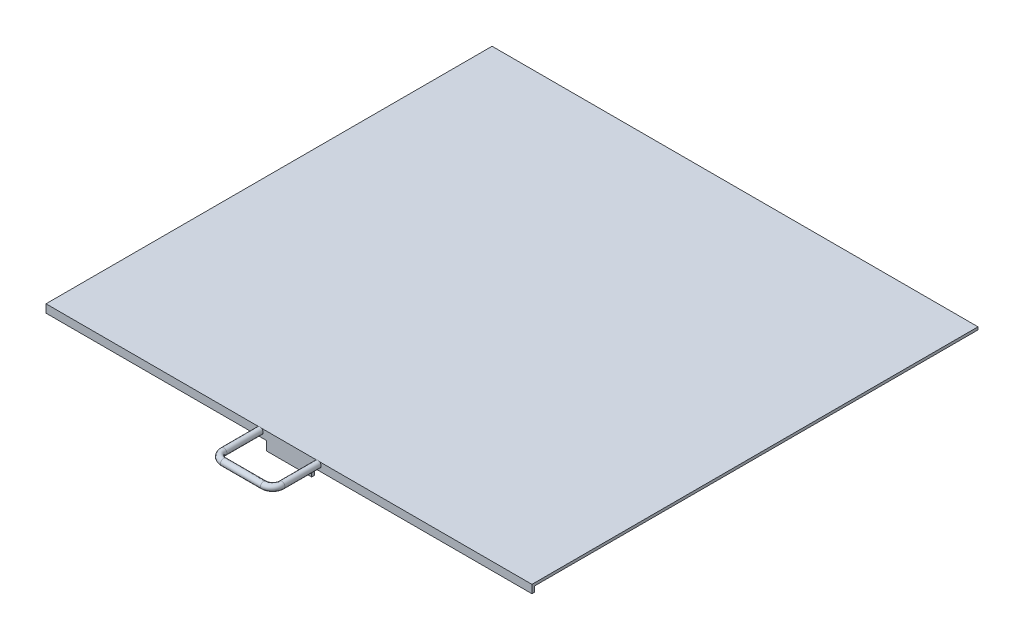
from build123d import *

# Parameters (mm, degrees)
SKETCH1_W           = 268
SKETCH1_H           = 246
BOSS_EXTRUDE1_DEPTH = 1.5
BOSS_EXTRUDE2_DEPTH = 1.5
SWEEP1_PROFILE_R    = 1.75


with BuildPart() as part:
    # Sketch1 → Boss-Extrude1 (new body)
    with BuildSketch(Plane(origin=(0, 0, 0), x_dir=(1, 0, 0), z_dir=(0, 1, 0))):
        Rectangle(SKETCH1_W, SKETCH1_H)
    extrude(amount=BOSS_EXTRUDE1_DEPTH)

    # Sketch2 → Boss-Extrude2 (add)
    with BuildSketch(Plane.XY.offset(123)):
        Polygon((-134, 0), (134, 0), (134, -3), (12.5, -3), (12.5, -8), (-12.5, -8), (-12.5, -3), (-134, -3), align=None)
    extrude(amount=-BOSS_EXTRUDE2_DEPTH)

    # Sweep1: sweep along a path in Sketch3
    with BuildLine(Plane(origin=(0, 0, 0), x_dir=(1, 0, 0), z_dir=(0, 1, 0))) as sweep1_path:
        Line((-16, -123), (-16, -143))
        ThreePointArc((-16, -143), (-14.535533906, -146.535533906), (-11, -148))
        Line((-11, -148), (11, -148))
        ThreePointArc((11, -148), (14.535533906, -146.535533906), (16, -143))
        Line((16, -143), (16, -123))
    # Sweep1 profile (on start of the path) → Sweep1 (sweep)
    with BuildSketch(Plane(origin=(-16, 0, 123), x_dir=(1, 0, 0), z_dir=(0, 0, 1))):
        Circle(SWEEP1_PROFILE_R)
    sweep(path=sweep1_path.line)


solid = part.part
